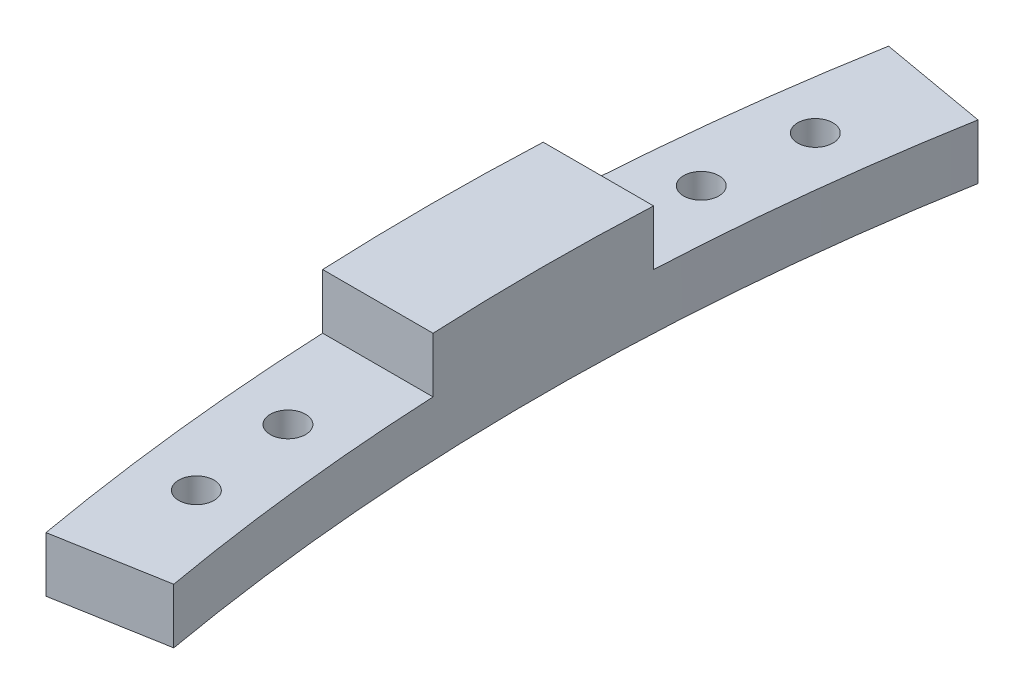
from build123d import *

# Parameters (mm, degrees)
BOSS_EXTRUDE1_DEPTH        = 5
F_3_2_3_2_DIAMETER_HOLE1_D = 3.2
BOSS_EXTRUDE2_DEPTH        = 5


with BuildPart() as part:
    # Sketch1 → Boss-Extrude1 (new body)
    with BuildSketch(Plane(origin=(0, 0, 0), x_dir=(1, 0, 0), z_dir=(0, 1, 0))):
        with BuildLine():
            Line((-216.657705663, 38.202599087), (-206.809628133, 36.46611731))
            ThreePointArc((-206.809628133, 36.46611731), (-210, 0), (-206.809628133, -36.46611731))
            Line((-206.809628133, -36.46611731), (-216.657705663, -38.202599087))
            ThreePointArc((-216.657705663, -38.202599087), (-220, 0), (-216.657705663, 38.202599087))
        make_face()
    extrude(amount=BOSS_EXTRUDE1_DEPTH)

    # Ø3.2 (3.2) Diameter Hole1 (through all)
    with Locations(Plane(origin=(0, 0, 0), x_dir=(-1, 0, 0), z_dir=(0, -1, 0))):
        with Locations((214.18186009, -18.738484691), (214.18186009, 18.738484691), (213.160645195, -28.063131327), (213.160645195, 28.063131327)):
            Hole(F_3_2_3_2_DIAMETER_HOLE1_D / 2)

    # Sketch9 → Boss-Extrude2 (add)
    with BuildSketch(Plane(origin=(0, 5, 0), x_dir=(1, 0, 0), z_dir=(0, 1, 0))):
        with BuildLine():
            Line((-219.772609758, 10), (-209.761769634, 10))
            ThreePointArc((-209.761769634, 10), (-210, 0), (-209.761769634, -10))
            Line((-209.761769634, -10), (-219.772609758, -10))
            ThreePointArc((-219.772609758, -10), (-220, 0), (-219.772609758, 10))
        make_face()
    extrude(amount=BOSS_EXTRUDE2_DEPTH)


solid = part.part
